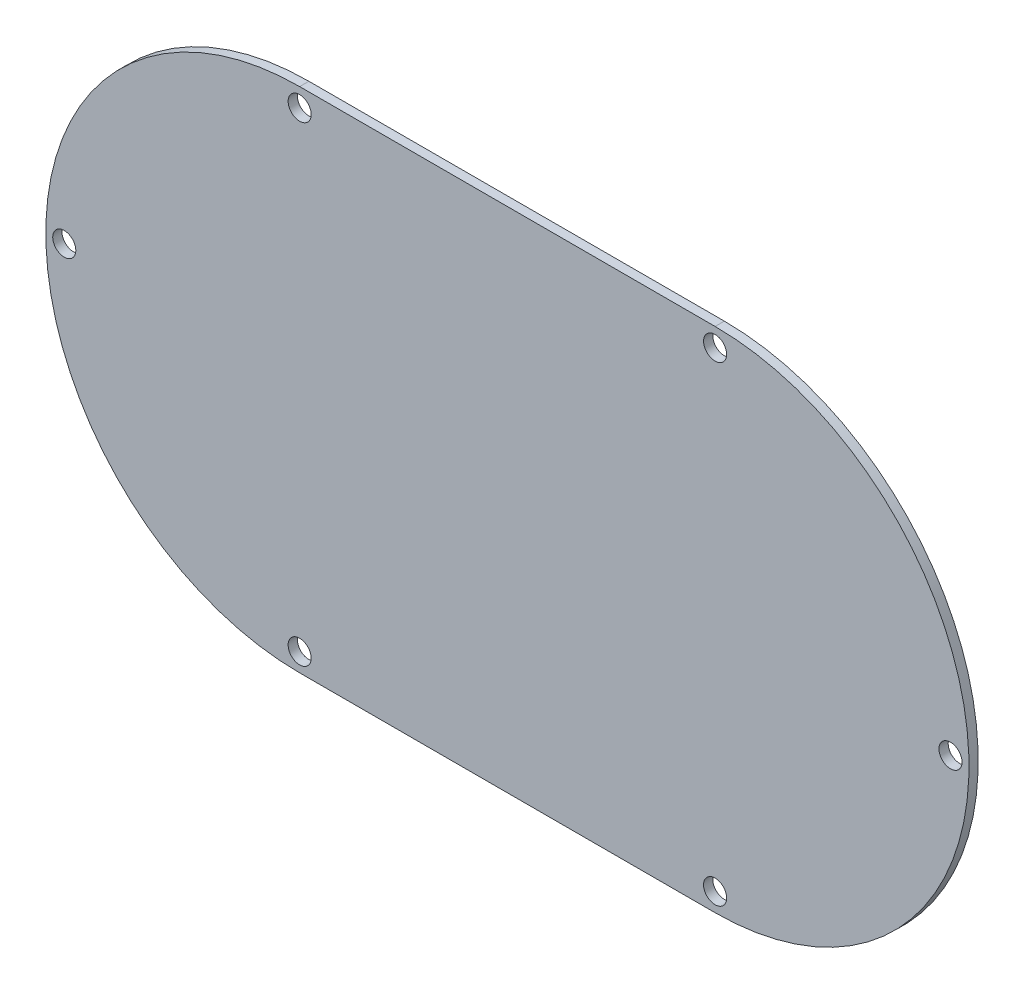
from build123d import *

# Parameters (mm, degrees)
EXTRUDE_1_DEPTH     = 2
SKETCH_2_R          = 2.5
CUT_EXTRUDE_1_DEPTH = 10


with BuildPart() as part:
    # 草图1 → 拉伸1 (new body)
    with BuildSketch(Plane.XY):
        with BuildLine():
            Line((0, 55), (90, 55))
            ThreePointArc((90, 55), (145, 0), (90, -55))
            Line((90, -55), (0, -55))
            ThreePointArc((0, -55), (-55, 0), (0, 55))
        make_face()
    extrude(amount=EXTRUDE_1_DEPTH)

    # 草图2 → 切除-拉伸1 (cut)
    with BuildSketch(Plane(origin=(0, 0, 0), x_dir=(-1, 0, 0), z_dir=(0, 0, -1))):
        with Locations((-90, 51)):
            Circle(SKETCH_2_R)
        with Locations((0, 51)):
            Circle(SKETCH_2_R)
        with Locations((51, 0)):
            Circle(SKETCH_2_R)
        with Locations(Location((0, -51, 0), (0, 0, 180))):
            Circle(SKETCH_2_R)
        with Locations(Location((-90, -51, 0), (0, 0, 180))):
            Circle(SKETCH_2_R)
        with Locations((-141, 0)):
            Circle(SKETCH_2_R)
    extrude(amount=-CUT_EXTRUDE_1_DEPTH, mode=Mode.SUBTRACT)


solid = part.part
